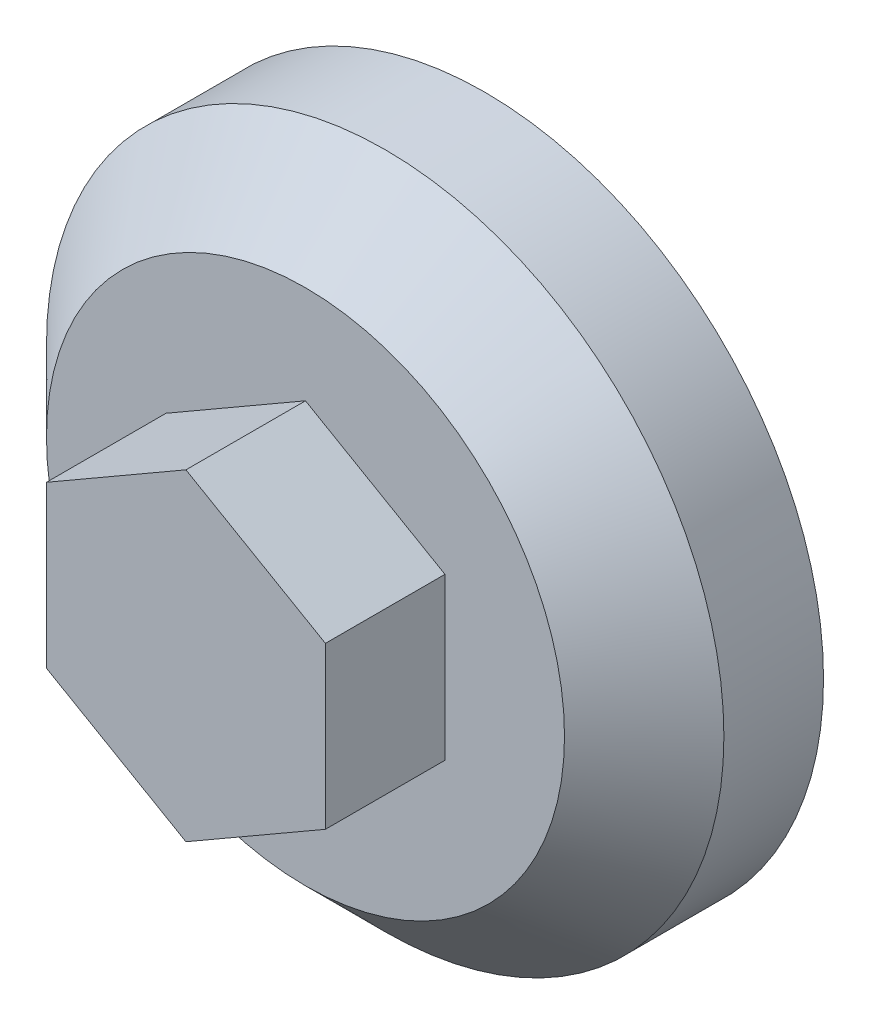
from build123d import *

# Parameters (mm, degrees)
EXTRUDE_START   = 9
EXTRUDE_1_DEPTH = 6


with BuildPart() as part:
    # Revolve profile 1 → Revolve 1 (revolve)
    with BuildSketch(Plane(origin=(0, 0, 0), x_dir=(1, 0, 0), z_dir=(0, 1, 0))):
        Polygon((0, 0), (17, 0), (17, -5), (13, -9), (0, -9), align=None)
    revolve(axis=Axis((0, 0, -5), (0, 0, 1)))


with BuildPart() as body_2:
    # Extrude sketch 1 → Extrude 1 (new body)
    with BuildSketch(Plane.XY.offset(EXTRUDE_START)):
        Polygon((7, 4.041451884), (0, 8.082903769), (-7, 4.041451884), (-7, -4.041451884), (0, -8.082903769), (7, -4.041451884), align=None)
    extrude(amount=EXTRUDE_1_DEPTH)


with BuildPart() as part_1:
    add(part.part)

    # Combine (weld / assembly of features): union body 2
    add(body_2.part)


solid = part_1.part
